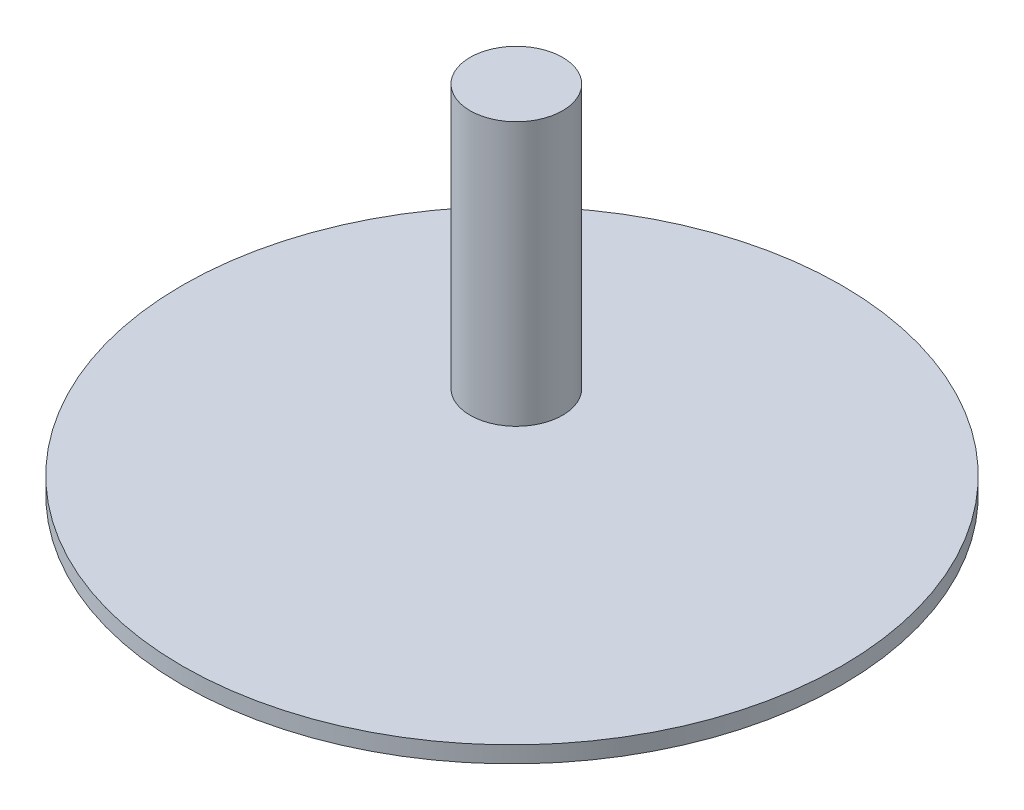
from build123d import *

# Parameters (mm, degrees)
SKETCH2_R           = 101.6
BOSS_EXTRUDE1_DEPTH = 5.08
SKETCH3_R           = 14.25
BOSS_EXTRUDE2_DEPTH = 81.28


with BuildPart() as part:
    # Sketch2 → Boss-Extrude1 (new body)
    with BuildSketch(Plane(origin=(0, 0, 0), x_dir=(1, 0, 0), z_dir=(0, 1, 0))):
        with Locations(Location((0, 0, 0), (0, 0, 270))):
            Circle(SKETCH2_R)
    extrude(amount=BOSS_EXTRUDE1_DEPTH)

    # Sketch3 → Boss-Extrude2 (add)
    with BuildSketch(Plane(origin=(0, 5.08, 0), x_dir=(1, 0, 0), z_dir=(0, 1, 0))):
        with Locations(Location((-22.565029174, 23.908185672, 0), (0, 0, 270))):
            Circle(SKETCH3_R)
    extrude(amount=BOSS_EXTRUDE2_DEPTH)


solid = part.part
